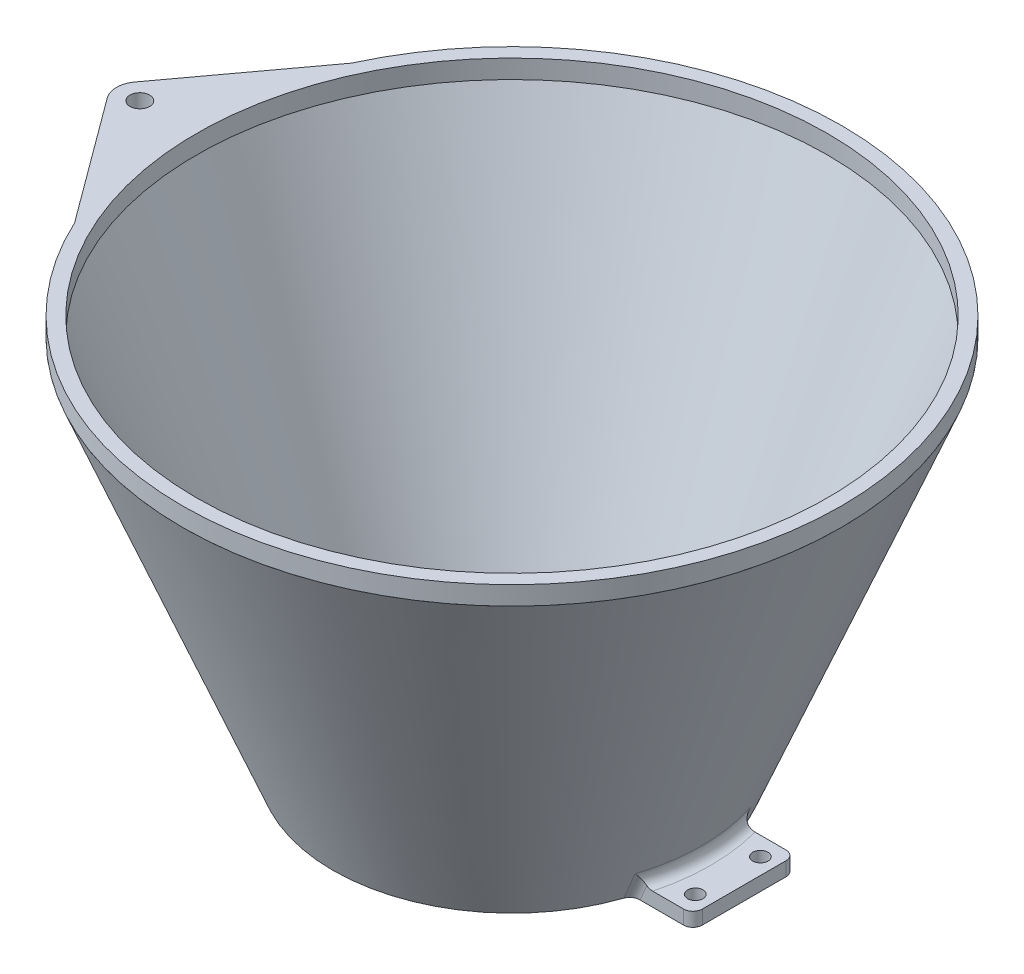
from build123d import *

# Parameters (mm, degrees)
SKETCH3_R           = 1.65
BOSS_EXTRUDE1_DEPTH = 3
FILLET1_R           = 2
SKETCH4_R           = 2.125
SKETCH4_R_2         = 67.822098067
BOSS_EXTRUDE2_DEPTH = 4


with BuildPart() as part:
    # Sketch2 → Revolve1 (revolve)
    with BuildSketch(Plane.XY, mode=Mode.PRIVATE) as revolve1_sk:
        Polygon((35.5, 0), (67.822098067, 80), (70.822098067, 80), (38.5, 0), align=None)
    revolve(revolve1_sk.sketch.rotate(Axis((0, 0, 0), (0, 1, 0)), 90), axis=Axis((0, 0, 0), (0, 1, 0)))

    # Sketch3 → Boss-Extrude1 (add)
    # profile 1 of 2: a face of its own
    with BuildSketch(Plane.XZ):
        with BuildLine():
            Line((-49.895121629, 11), (-36.895121629, 11))
            ThreePointArc((-36.895121629, 11), (-38.5, 0), (-36.895121629, -11))
            Line((-36.895121629, -11), (-49.895121629, -11))
            Line((-49.895121629, -11), (-49.895121629, 11))
        make_face()
        with Locations(Location((-46.395121629, -7, 0), (0, 0, 270))):
            Circle(SKETCH3_R, mode=Mode.SUBTRACT)
        with Locations(Location((-46.395121629, 7, 0), (0, 0, 90))):
            Circle(SKETCH3_R, mode=Mode.SUBTRACT)
    # profile 2 of 2: a face of its own
    with BuildSketch(Plane.XZ):
        with BuildLine():
            Line((49.895121629, -11), (36.895121629, -11))
            ThreePointArc((36.895121629, -11), (38.5, 0), (36.895121629, 11))
            Line((36.895121629, 11), (49.895121629, 11))
            Line((49.895121629, 11), (49.895121629, -11))
        make_face()
        with Locations(Location((46.395121629, 7, 0), (0, 0, 270))):
            Circle(SKETCH3_R, mode=Mode.SUBTRACT)
        with Locations(Location((46.395121629, -7, 0), (0, 0, 90))):
            Circle(SKETCH3_R, mode=Mode.SUBTRACT)
    extrude(amount=-BOSS_EXTRUDE1_DEPTH)

    # Fillet1
    fillet1_edges = [part.edges().sort_by_distance(p)[0] for p in [
        (-39.712078678, 3, 0),
        (-37.527024392, 1.499849586, -11),
        (-37.527024392, 1.499849586, 11),
        (-49.895121629, 1.5, -11),
        (-49.895121629, 1.5, 11),
        (39.712078678, 3, 0),
        (37.527024392, 1.499849586, -11),
        (37.527024392, 1.499849586, 11),
        (49.895121629, 1.5, 11),
        (49.895121629, 1.5, -11),
    ]]
    fillet(fillet1_edges, radius=FILLET1_R)


with BuildPart() as body_2:
    # Sketch4 → Boss-Extrude2 (new body)
    with BuildSketch(Plane(origin=(0, 80, 0), x_dir=(1, 0, 0), z_dir=(0, 1, 0))):
        with BuildLine():
            Line((-64.279201496, 29.731361045), (-84.023539016, 2.968355401))
            ThreePointArc((-84.023539016, 2.968355401), (-85, 0), (-84.023539016, -2.968355401))
            Line((-84.023539016, -2.968355401), (-64.279201496, -29.731361045))
            ThreePointArc((-64.279201496, -29.731361045), (70.822098067, 0), (-64.279201496, 29.731361045))
        make_face()
        with Locations(Location((-80, 0, 0), (0, 0, 270))):
            Circle(SKETCH4_R, mode=Mode.SUBTRACT)
        with Locations(Location((0, 0, 0), (0, 0, 270))):
            Circle(SKETCH4_R_2, mode=Mode.SUBTRACT)
    extrude(amount=BOSS_EXTRUDE2_DEPTH)


solid = Compound([part.part, body_2.part])
